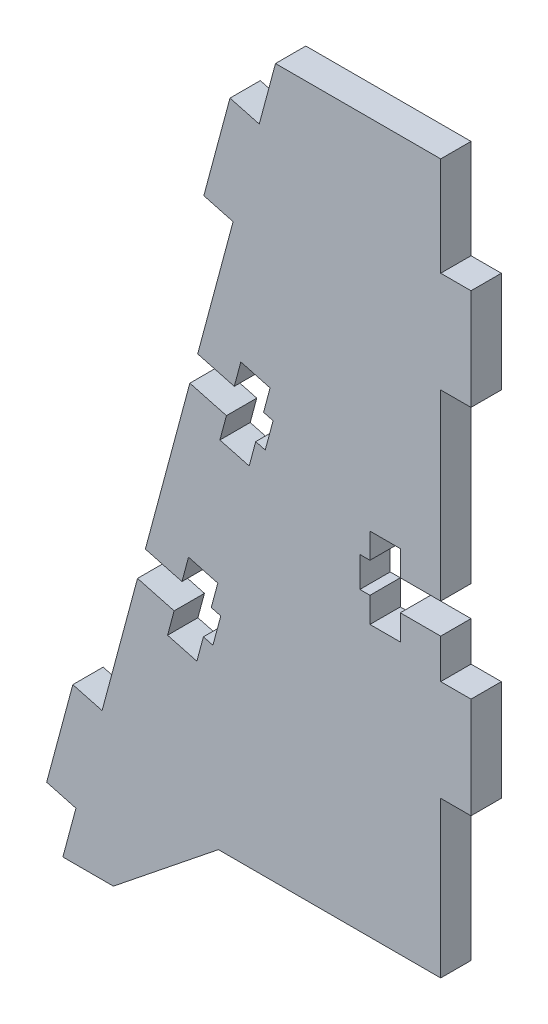
from build123d import *

# Parameters (mm, degrees)
SALIENTE_EXTRUIR1_DEPTH = 1.5


with BuildPart() as part:
    # Croquis1 → Saliente-Extruir1 (new, symmetric)
    with BuildSketch(Plane.XY):
        Polygon((484.855720511, 82.973038085), (491.215178715, 82.973038085), (501.205555648, 82.973038085), (501.205555648, 73.173108985), (504.205555648, 73.173108985), (504.205555648, 63.173108985), (501.205555648, 63.173108985), (501.205555648, 45.073108985), (497.205555648, 45.073108985), (497.205555648, 47.573108985), (494.205555648, 47.573108985), (494.205555648, 45.073108985), (493.205555648, 45.073108985), (493.205555648, 42.073108985), (494.205555648, 42.073108985), (494.205555648, 39.573108985), (497.205555648, 39.573108985), (497.205555648, 42.073108985), (501.205555648, 42.073108985), (501.205555648, 38.173108985), (504.205555648, 38.173108985), (504.205555648, 28.173108985), (501.205555648, 28.173108985), (501.205555648, 12.773108985), (494.855720505, 12.773108985), (479.205555648, 12.773108985), (468.814796849, 4.447241951), (463.814796852, 4.447241951), (465.108892077, 9.276871079), (462.2111146, 10.053328214), (464.799305049, 19.712586471), (467.697082526, 18.936129336), (471.203015891, 32.02045078), (474.824900651, 31.049969683), (474.177853039, 28.635155119), (477.075967602, 27.858607662), (477.723015214, 30.273422227), (478.664792894, 30.021073658), (479.441250029, 32.918851135), (478.499472349, 33.171199704), (479.146628347, 35.586418771), (476.248513785, 36.362966228), (475.601357786, 33.94774716), (471.979473025, 34.918228257), (476.379396799, 51.33896733), (480.001281419, 50.368486271), (479.354233806, 47.953671707), (482.252348369, 47.177124251), (482.899395981, 49.591938815), (483.841173662, 49.339590246), (484.617630796, 52.237367723), (483.675853116, 52.489716292), (484.323009115, 54.904935359), (481.424894552, 55.681482816), (480.777738553, 53.266263749), (477.155853934, 54.236744807), (480.661787289, 67.321066215), (477.764009811, 68.097523349), (480.352200261, 77.756781606), (483.249977738, 76.980324471), align=None)
    extrude(amount=SALIENTE_EXTRUIR1_DEPTH, both=True)


solid = part.part
